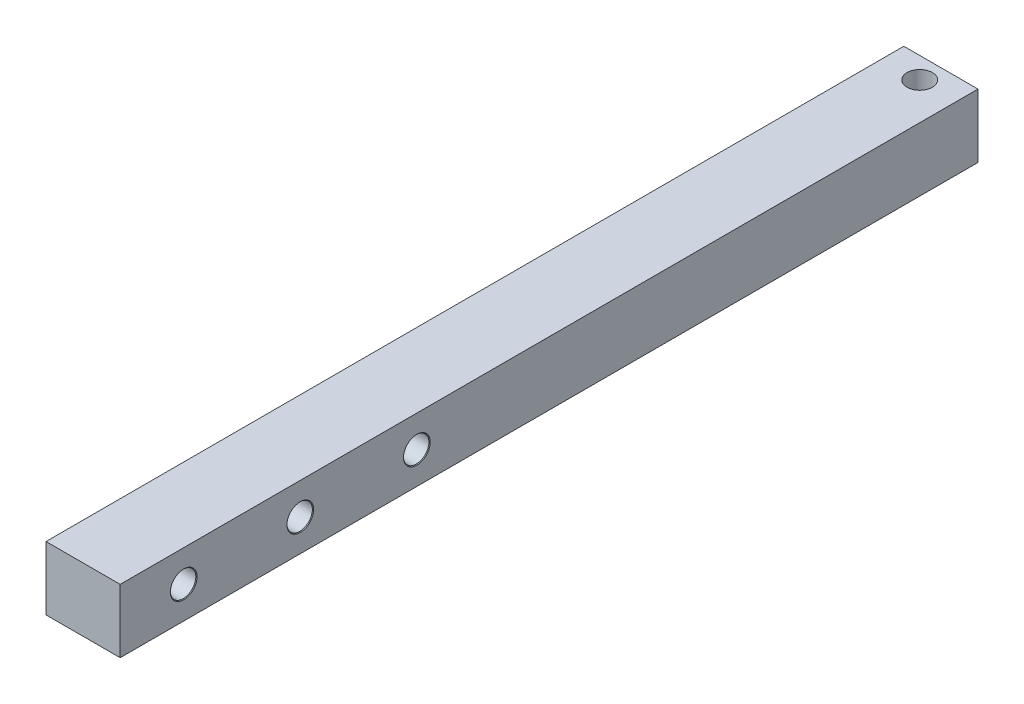
from build123d import *

# Parameters (mm, degrees)
SKETCH1_W           = 35
SKETCH1_H           = 30
BOSS_EXTRUDE1_DEPTH = 202.4
SKETCH4_R           = 6
CUT_EXTRUDE1_DEPTH  = 211.132863092
SKETCH5_R           = 6
CUT_EXTRUDE2_DEPTH  = 208.132591643
CHAMFER1_SIZE       = 0.3


with BuildPart() as part:
    # Sketch1 → Boss-Extrude1 (new, symmetric)
    with BuildSketch(Plane.XY):
        with Locations((14.720343273, -29.328998989)):
            Rectangle(SKETCH1_W, SKETCH1_H)
    extrude(amount=BOSS_EXTRUDE1_DEPTH, both=True)

    # Sketch4 → Cut-Extrude1 (cut, through all)
    with BuildSketch(Plane.ZY.offset(2.779656727)):
        with Locations(Location((172.4, -29.328998989, 0), (0, 0, 270))):
            Circle(SKETCH4_R)
        with Locations(Location((62.4, -29.328998989, 0), (0, 0, 270))):
            Circle(SKETCH4_R)
        with Locations(Location((117.4, -29.328998989, 0), (0, 0, 270))):
            Circle(SKETCH4_R)
    extrude(amount=-CUT_EXTRUDE1_DEPTH, mode=Mode.SUBTRACT)

    # Sketch5 → Cut-Extrude2 (cut, through all)
    with BuildSketch(Plane(origin=(0, -14.328998989, 0), x_dir=(1, 0, 0), z_dir=(0, 1, 0))):
        with Locations(Location((14.720343273, 192.4, 0), (0, 0, 270))):
            Circle(SKETCH5_R)
    extrude(amount=-CUT_EXTRUDE2_DEPTH, mode=Mode.SUBTRACT)

    # Chamfer1
    chamfer1_edges = [part.edges().sort_by_distance(p)[0] for p in [
        (32.220343273, -23.328998989, 172.4),
        (-2.779656727, -23.328998989, 172.4),
        (32.220343273, -23.328998989, 62.4),
        (-2.779656727, -23.328998989, 62.4),
        (32.220343273, -23.328998989, 117.4),
        (-2.779656727, -23.328998989, 117.4),
    ]]
    chamfer(chamfer1_edges, length=CHAMFER1_SIZE)


solid = part.part
